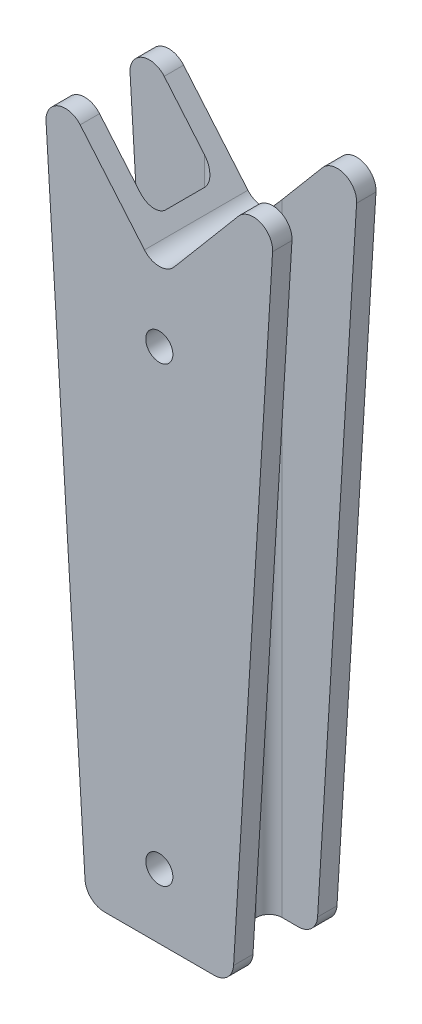
from build123d import *

# Parameters (mm, degrees)
EXTRUDE_1_DEPTH     = 3
EXTRUDE_2_DEPTH     = 10
EXTRUDE_3_DEPTH     = 3
FILLET_1_R          = 2
SKETCH_4_R          = 2.1
CUT_EXTRUDE_1_DEPTH = 37


with BuildPart() as part:
    # 草图1 → 凸台-拉伸1 (new body)
    with BuildSketch(Plane.XY):
        with BuildLine():
            Line((-12.241114452, 51.269005321), (-2.292502811, 39.48265225))
            ThreePointArc((-2.292502811, 39.48265225), (0, 38.417705443), (2.292502811, 39.48265225))
            Line((2.292502811, 39.48265225), (12.241114452, 51.269005321))
            ThreePointArc((12.241114452, 51.269005321), (15.649349314, 52.118757685), (17.528021658, 49.150806509))
            Line((17.528021658, 49.150806509), (11.493234109, -49.517097746))
            ThreePointArc((11.493234109, -49.517097746), (10.554378685, -51.519065037), (8.498829714, -52.333952128))
            Line((8.498829714, -52.333952128), (-8.498829714, -52.333952128))
            ThreePointArc((-8.498829714, -52.333952128), (-10.554378685, -51.519065037), (-11.493234109, -49.517097746))
            Line((-11.493234109, -49.517097746), (-17.528021658, 49.150806509))
            ThreePointArc((-17.528021658, 49.150806509), (-15.649349314, 52.118757685), (-12.241114452, 51.269005321))
        make_face()
    extrude(amount=EXTRUDE_1_DEPTH)

    # 草图2 → 凸台-拉伸2 (add)
    with BuildSketch(Plane.XY.offset(3)):
        with BuildLine():
            Line((-4, -52.333952128), (-4, 41.505564136))
            Line((-4, 41.505564136), (-2.292502811, 39.48265225))
            ThreePointArc((-2.292502811, 39.48265225), (0, 38.417705443), (2.292502811, 39.48265225))
            Line((2.292502811, 39.48265225), (4, 41.505564136))
            Line((4, 41.505564136), (4, -52.333952128))
            Line((4, -52.333952128), (-4, -52.333952128))
        make_face()
    extrude(amount=EXTRUDE_2_DEPTH)

    # 草图3 → 凸台-拉伸3 (add)
    with BuildSketch(Plane.XY.offset(13)):
        with BuildLine():
            Line((-12.241114452, 51.269005321), (-2.292502811, 39.48265225))
            ThreePointArc((-2.292502811, 39.48265225), (0, 38.417705443), (2.292502811, 39.48265225))
            Line((2.292502811, 39.48265225), (12.241114452, 51.269005321))
            ThreePointArc((12.241114452, 51.269005321), (15.649349314, 52.118757685), (17.528021658, 49.150806509))
            Line((17.528021658, 49.150806509), (11.493234109, -49.517097746))
            ThreePointArc((11.493234109, -49.517097746), (10.554378685, -51.519065037), (8.498829714, -52.333952128))
            Line((8.498829714, -52.333952128), (-8.498829714, -52.333952128))
            ThreePointArc((-8.498829714, -52.333952128), (-10.554378685, -51.519065037), (-11.493234109, -49.517097746))
            Line((-11.493234109, -49.517097746), (-17.528021658, 49.150806509))
            ThreePointArc((-17.528021658, 49.150806509), (-15.649349314, 52.118757685), (-12.241114452, 51.269005321))
        make_face()
    extrude(amount=EXTRUDE_3_DEPTH)

    # 圆角1
    fillet_1_edges = [part.edges().sort_by_distance(p)[0] for p in [
        (4, -5.414193996, 3),
        (-4, -5.414193996, 3),
        (4, -5.414193996, 13),
        (-4, -5.414193996, 13),
    ]]
    fillet(fillet_1_edges, radius=FILLET_1_R)

    # 草图4 → 切除-拉伸1 (cut)
    with BuildSketch(Plane.XY.offset(16)):
        with Locations((0, -42.333952128)):
            Circle(SKETCH_4_R)
        with Locations((0, 27.666047872)):
            Circle(SKETCH_4_R)
    extrude(amount=-CUT_EXTRUDE_1_DEPTH, mode=Mode.SUBTRACT)


solid = part.part
